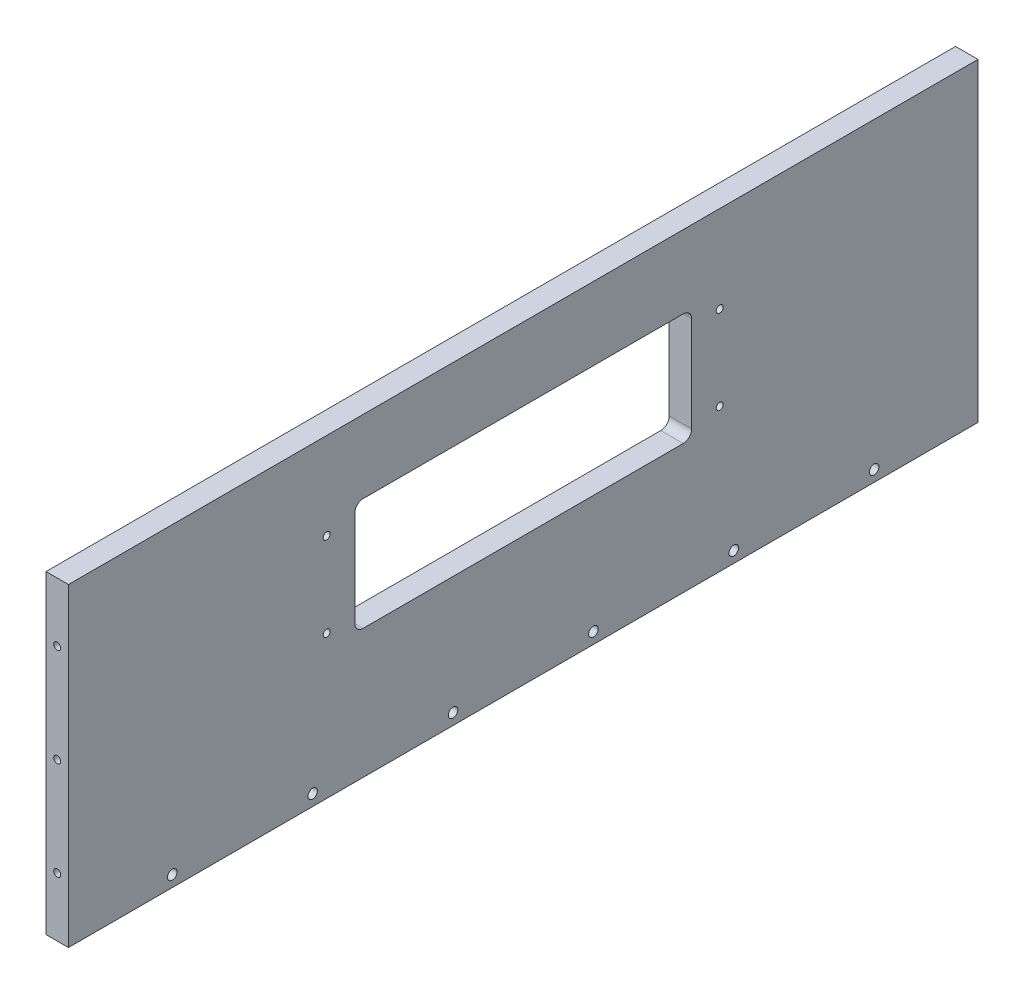
from build123d import *

# Parameters (mm, degrees)
SKETCH1_W                                     = 324
SKETCH1_H                                     = 112
BOSS_EXTRUDE1_DEPTH                           = 8
M3X0_5_TAPPED_HOLE1_AT_2_COUNT                = 2
M3X0_5_TAPPED_HOLE1_AT_2_PITCH                = 35
M3X0_5_TAPPED_HOLE1_AT_3_COUNT                = 2
M3X0_5_TAPPED_HOLE1_AT_3_PITCH                = 70
CSK_FOR_M3_COUNTERSUNK_FLAT_HEAD1_D           = 3.4
CSK_FOR_M3_COUNTERSUNK_FLAT_HEAD1_DEPTH       = 11.5
CSK_FOR_M3_COUNTERSUNK_FLAT_HEAD1_CSINK_D     = 6.3
CSK_FOR_M3_COUNTERSUNK_FLAT_HEAD1_CSINK_ANGLE = 90
CSK_FOR_M3_COUNTERSUNK_FLAT_HEAD1_TIP         = 1.021463052
SKETCH9_W                                     = 120
SKETCH9_H                                     = 40
CUT_EXTRUDE1_DEPTH                            = 172.59254063
M3X0_5_TAPPED_HOLE2_D                         = 2.5
FILLET1_R                                     = 3


with BuildPart() as part:
    # Sketch1 → Boss-Extrude1 (new body)
    with BuildSketch(Plane(origin=(0, 0, 0), x_dir=(0, 0, -1), z_dir=(1, 0, 0))):
        Rectangle(SKETCH1_W, SKETCH1_H)
    extrude(amount=BOSS_EXTRUDE1_DEPTH)

    # Sketch4 → M3x0.5 Tapped Hole1 (revolve, cut)
    with BuildSketch(Plane(origin=(4, 35, 162), x_dir=(0, -1, 0), z_dir=(1, 0, 0))):
        Polygon((0, 0), (0, 12.251075774), (1.25, 11.5), (1.25, 0), align=None)
    m3x0_5_tapped_hole1 = revolve(axis=Axis((4, 35, 168.35), (0, 0, -1)), mode=Mode.SUBTRACT)

    # M3x0.5 Tapped Hole1 at 2: M3x0.5 Tapped Hole1 ×2
    with Locations(*[(0, -i * M3X0_5_TAPPED_HOLE1_AT_2_PITCH, 0) for i in range(1, M3X0_5_TAPPED_HOLE1_AT_2_COUNT)]):
        add(m3x0_5_tapped_hole1, mode=Mode.SUBTRACT)

    # M3x0.5 Tapped Hole1 at 3: M3x0.5 Tapped Hole1 ×2
    with Locations(*[(0, -i * M3X0_5_TAPPED_HOLE1_AT_3_PITCH, 0) for i in range(1, M3X0_5_TAPPED_HOLE1_AT_3_COUNT)]):
        add(m3x0_5_tapped_hole1, mode=Mode.SUBTRACT)

    # Mirror1: M3x0.5 Tapped Hole1 across plane
    add(m3x0_5_tapped_hole1.mirror(Plane.XY), mode=Mode.SUBTRACT)

    # Mirror1 copy 1 sketch → Mirror1 copy 1 (revolve, cut)
    with BuildSketch(Plane(origin=(4, 0, -162), x_dir=(0, -1, 0), z_dir=(1, 0, 0))):
        Polygon((0, 0), (0, -12.251075774), (1.25, -11.5), (1.25, 0), align=None)
    revolve(axis=Axis((4, 0, -168.35), (0, 0, -1)), mode=Mode.SUBTRACT)

    # Mirror1 copy 2 sketch → Mirror1 copy 2 (revolve, cut)
    with BuildSketch(Plane(origin=(4, -35, -162), x_dir=(0, -1, 0), z_dir=(1, 0, 0))):
        Polygon((0, 0), (0, -12.251075774), (1.25, -11.5), (1.25, 0), align=None)
    revolve(axis=Axis((4, -35, -168.35), (0, 0, -1)), mode=Mode.SUBTRACT)

    # CSK for M3 Countersunk Flat Head1
    with Locations(Plane(origin=(0, -52, -125), x_dir=(0, 0, -1), z_dir=(-1, 0, 0))):
        with Locations((0, 0), (-50, 0), (-100, 0), (-150, 0), (-200, 0), (-250, 0)):
            CounterSinkHole(CSK_FOR_M3_COUNTERSUNK_FLAT_HEAD1_D / 2, CSK_FOR_M3_COUNTERSUNK_FLAT_HEAD1_CSINK_D / 2, depth=CSK_FOR_M3_COUNTERSUNK_FLAT_HEAD1_DEPTH, counter_sink_angle=CSK_FOR_M3_COUNTERSUNK_FLAT_HEAD1_CSINK_ANGLE)
            with Locations((0, 0, -(CSK_FOR_M3_COUNTERSUNK_FLAT_HEAD1_DEPTH + CSK_FOR_M3_COUNTERSUNK_FLAT_HEAD1_TIP / 2))):  # 118° drill point
                Cone(0, CSK_FOR_M3_COUNTERSUNK_FLAT_HEAD1_D / 2, CSK_FOR_M3_COUNTERSUNK_FLAT_HEAD1_TIP, mode=Mode.SUBTRACT)

    # Sketch9 → Cut-Extrude1 (cut, through all)
    with BuildSketch(Plane.ZY):
        with Locations((0, 10)):
            Rectangle(SKETCH9_W, SKETCH9_H)
    extrude(amount=-CUT_EXTRUDE1_DEPTH, mode=Mode.SUBTRACT)

    # M3x0.5 Tapped Hole2 (through all)
    with Locations(Plane(origin=(0, 25, -70), x_dir=(0, 0, -1), z_dir=(-1, 0, 0))):
        with Locations((0, 0), (0, 30)):
            m3x0_5_tapped_hole2 = Hole(M3X0_5_TAPPED_HOLE2_D / 2)

    # Mirror2: M3x0.5 Tapped Hole2 across plane
    add(m3x0_5_tapped_hole2.mirror(Plane.XY), mode=Mode.SUBTRACT)

    # Fillet1
    fillet1_edges = [part.edges().sort_by_distance(p)[0] for p in [
        (4, -10, -60),
        (4, 30, -60),
        (4, 30, 60),
        (4, -10, 60),
    ]]
    fillet(fillet1_edges, radius=FILLET1_R)


solid = part.part
